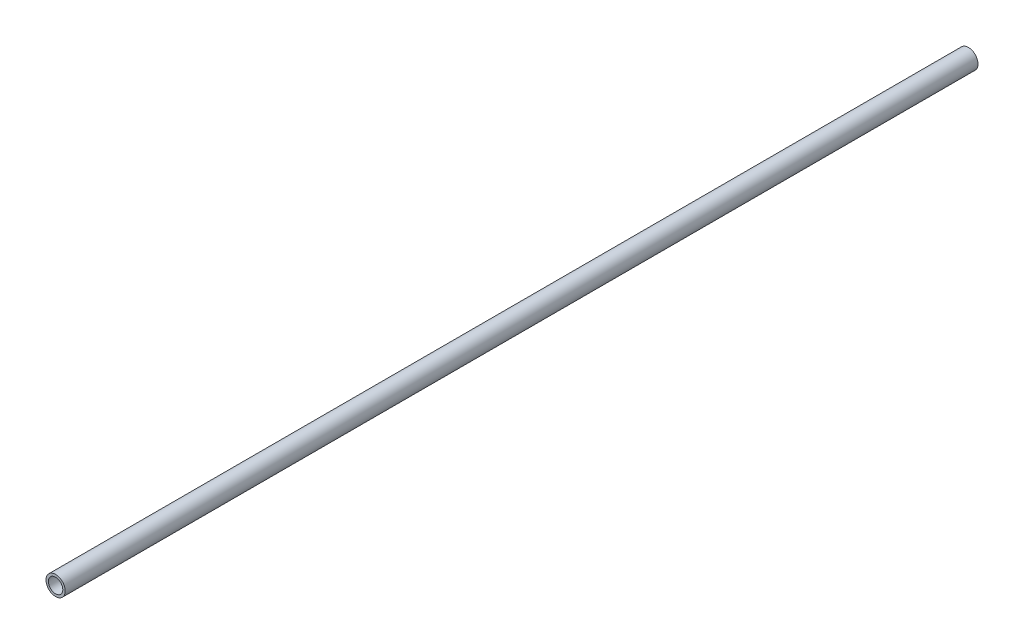
from build123d import *

# Parameters (mm, degrees)
SKETCH_1_R      = 4
SKETCH_1_R_2    = 3
EXTRUDE_1_DEPTH = 380


with BuildPart() as part:
    # Эскиз1 → Бобышка-Вытянуть1 (new body)
    with BuildSketch(Plane.XY):
        Circle(SKETCH_1_R)
        Circle(SKETCH_1_R_2, mode=Mode.SUBTRACT)
    extrude(amount=EXTRUDE_1_DEPTH)


solid = part.part
